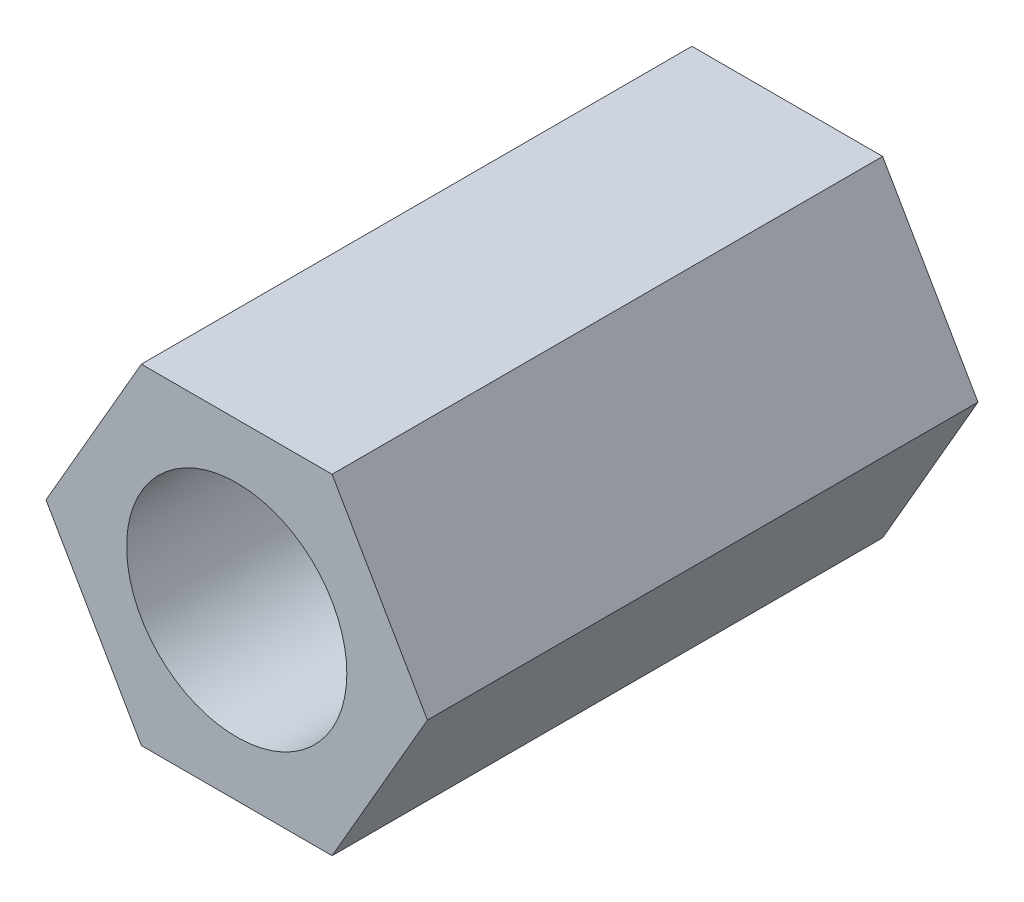
from build123d import *

# Parameters (mm, degrees)
ESQUISSE1_R        = 2
BOSS_EXTRU_1_DEPTH = 10


with BuildPart() as part:
    # Esquisse1 → Boss.-Extru.1 (new body)
    with BuildSketch(Plane.XY):
        Polygon((-3.464101615, 0), (-1.732050808, -3), (1.732050808, -3), (3.464101615, 0), (1.732050808, 3), (-1.732050808, 3), align=None)
        Circle(ESQUISSE1_R, mode=Mode.SUBTRACT)
    extrude(amount=BOSS_EXTRU_1_DEPTH)


solid = part.part
